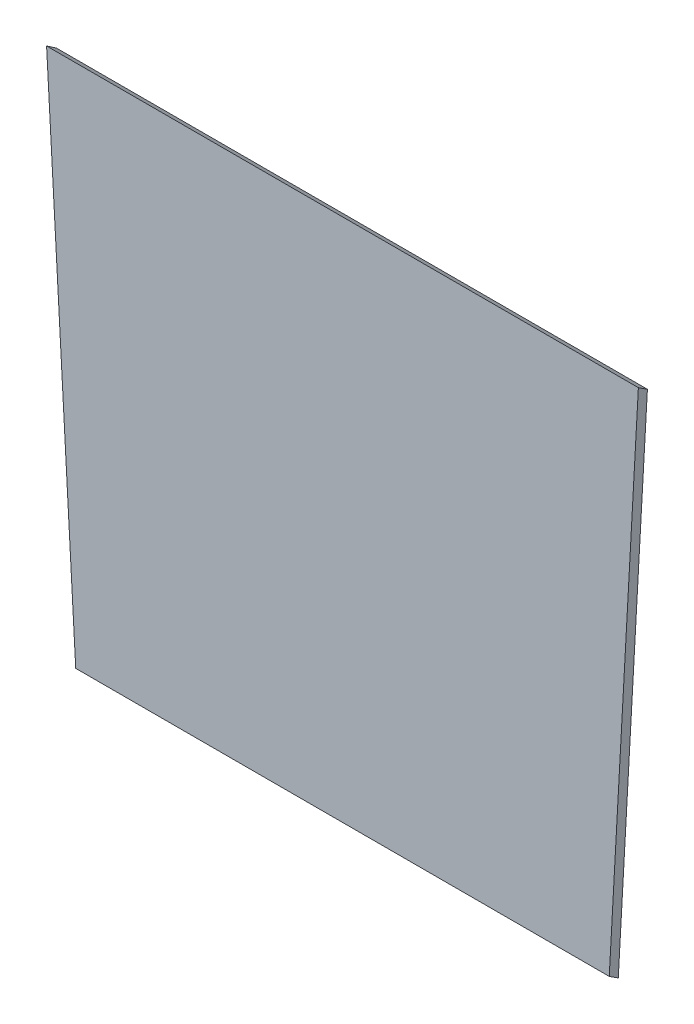
from build123d import *

# Parameters (mm, degrees)
BOSS_EXTRU_1_DEPTH           = 30
ENL_V_MAT_EXTRU_1_DEPTH      = 1493.145
ENL_V_MAT_EXTRU_1_DEPTH_BACK = 523.145


with BuildPart() as part:
    # Esquisse1 → Boss.-Extru.1 (new body)
    with BuildSketch(Plane.XY):
        Polygon((-469.958925703, 973.254734923), (1423.152431777, 973.254734923), (1328.847374932, -724.35899061), (-375.653868858, -724.35899061), align=None)
    extrude(amount=BOSS_EXTRU_1_DEPTH)

    # Esquisse3 → Enlèv. mat.-Extru.1 (cut, two sides: drawn at the far end of the back side and taken through both)
    with BuildSketch(Plane(origin=(0, 0, 0), x_dir=(0, 0, -1), z_dir=(1, 0, 0)).offset(-ENL_V_MAT_EXTRU_1_DEPTH_BACK)):
        Polygon((-30, -724.35899061), (0, -724.35899061), (-30, -704.404388529), align=None)
        Polygon((-30, 973.254734923), (0, 973.254734923), (0, 953.300132842), align=None)
    extrude(amount=ENL_V_MAT_EXTRU_1_DEPTH + ENL_V_MAT_EXTRU_1_DEPTH_BACK, mode=Mode.SUBTRACT)


solid = part.part
